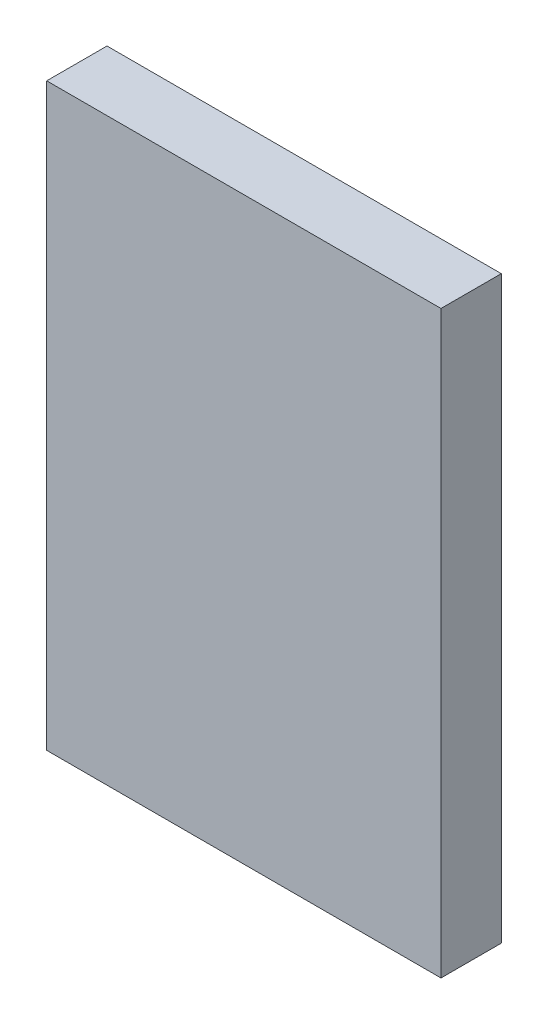
from build123d import *

# Parameters (mm, degrees)
SKETCH_1_W      = 34
SKETCH_1_H      = 50
EXTRUDE_1_DEPTH = 5.2


with BuildPart() as part:
    # 草图1 → 凸台-拉伸1 (new body)
    with BuildSketch(Plane.XY):
        with Locations((5.875494071, 9.359972528)):
            Rectangle(SKETCH_1_W, SKETCH_1_H)
    extrude(amount=EXTRUDE_1_DEPTH)


solid = part.part
